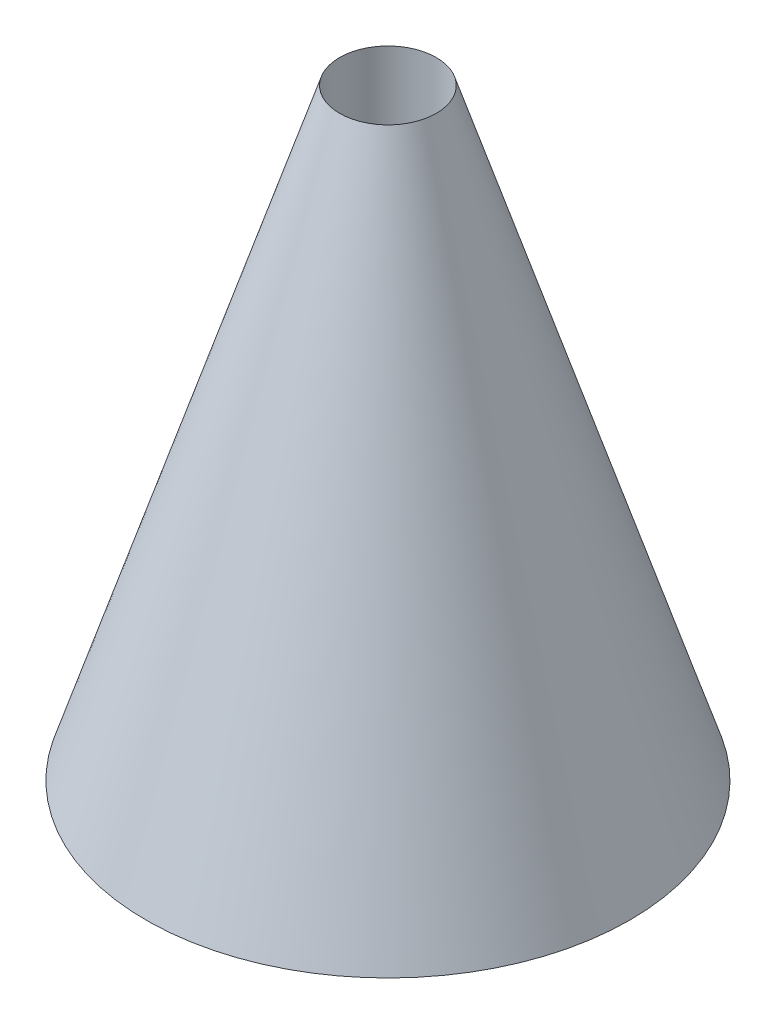
from build123d import *

# Parameters (mm, degrees)
SKETCH2_R          = 2.54
CUT_EXTRUDE1_DEPTH = 40.838343339


with BuildPart() as part:
    # Sketch1 → Revolve1 (revolve)
    with BuildSketch(Plane.XY):
        Polygon((0, 0), (12.7, 0), (1.27, 35.56), (0, 35.56), align=None)
    revolve(axis=Axis((0, 35.56, 0), (0, -1, 0)))

    # Sketch2 → Cut-Extrude1 (cut, through all)
    with BuildSketch(Plane(origin=(0, 35.56, 0), x_dir=(1, 0, 0), z_dir=(0, 1, 0))):
        with Locations(Location((0, 0, 0), (0, 0, 180))):
            Circle(SKETCH2_R)
    extrude(amount=-CUT_EXTRUDE1_DEPTH, mode=Mode.SUBTRACT)


solid = part.part
